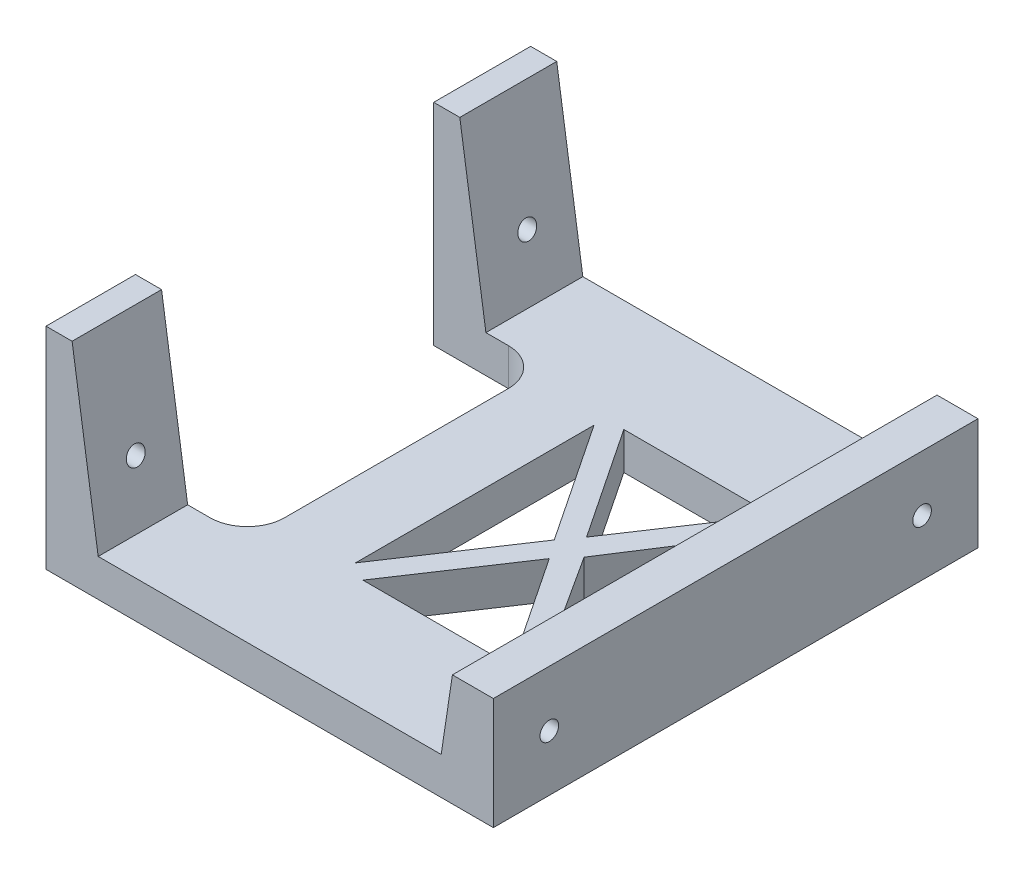
from build123d import *

# Parameters (mm, degrees)
BOSS_EXTRUDE1_DEPTH = 82.55
CUT_EXTRUDE1_DEPTH  = 50.8
FILLET1_R           = 6.35
SKETCH3_W           = 18.816678221
SKETCH3_H           = 21.85775753
CUT_EXTRUDE2_DEPTH  = 101.6
CUT_EXTRUDE3_DEPTH  = 50.8
SKETCH5_R           = 1.5875
CUT_EXTRUDE4_DEPTH  = 25.4
SKETCH6_R           = 1.5875
CUT_EXTRUDE5_DEPTH  = 10.16


with BuildPart() as part:
    # Sketch1 → Boss-Extrude1 (new body)
    with BuildSketch(Plane.XY):
        Polygon((-20.934516129, 0), (55.265483871, 0), (55.265483871, 35.8775), (50.820483871, 35.8775), (46.375483871, 6.35), (-12.044516129, 6.35), (-16.489516129, 35.8775), (-20.934516129, 35.8775), align=None)
    extrude(amount=BOSS_EXTRUDE1_DEPTH)

    # Sketch2 → Cut-Extrude1 (cut)
    with BuildSketch(Plane(origin=(0, 35.8775, 0), x_dir=(1, 0, 0), z_dir=(0, 1, 0))):
        Polygon((-1.884516129, -53.975), (-1.884516129, -28.575), (-1.884516129, -16.51), (-20.934516129, -16.51), (-20.934516129, -67.31), (-1.884516129, -67.31), align=None)
    extrude(amount=-CUT_EXTRUDE1_DEPTH, mode=Mode.SUBTRACT)

    # Fillet1
    fillet1_edges = [part.edges().sort_by_distance(p)[0] for p in [
        (-1.884516129, 3.175, 16.51),
        (-1.884516129, 3.175, 67.31),
    ]]
    fillet(fillet1_edges, radius=FILLET1_R)

    # Sketch3 → Cut-Extrude2 (cut)
    with BuildSketch(Plane.XY.offset(82.55)):
        with Locations((52.042862191, 29.978878765)):
            Rectangle(SKETCH3_W, SKETCH3_H)
    extrude(amount=-CUT_EXTRUDE2_DEPTH, mode=Mode.SUBTRACT)

    # Sketch4 → Cut-Extrude3 (cut)
    with BuildSketch(Plane.XZ):
        Polygon((13.990483871, 63.5), (39.390483871, 63.5), (26.690483871, 44.45), align=None)
        Polygon((10.815483871, 61.595), (24.362150538, 41.275), (10.815483871, 20.955), align=None)
        Polygon((42.565483871, 61.595), (42.565483871, 20.955), (29.442150538, 41.275), align=None)
        Polygon((13.990483871, 19.05), (26.690483871, 38.1), (39.390483871, 19.05), align=None)
    extrude(amount=-CUT_EXTRUDE3_DEPTH, mode=Mode.SUBTRACT)

    # Sketch5 → Cut-Extrude4 (cut)
    with BuildSketch(Plane.ZY.offset(20.934516129)):
        with Locations(Location((7.9375, 16.51, 0), (0, 0, 270))):
            Circle(SKETCH5_R)
        with Locations(Location((74.6125, 16.51, 0), (0, 0, 270))):
            Circle(SKETCH5_R)
    extrude(amount=-CUT_EXTRUDE4_DEPTH, mode=Mode.SUBTRACT)

    # Sketch6 → Cut-Extrude5 (cut)
    with BuildSketch(Plane(origin=(55.265483871, 0, 0), x_dir=(0, 0, -1), z_dir=(1, 0, 0))):
        with Locations((-9.525, 9.525)):
            Circle(SKETCH6_R)
        with Locations((-73.025, 9.525)):
            Circle(SKETCH6_R)
    extrude(amount=-CUT_EXTRUDE5_DEPTH, mode=Mode.SUBTRACT)


solid = part.part
